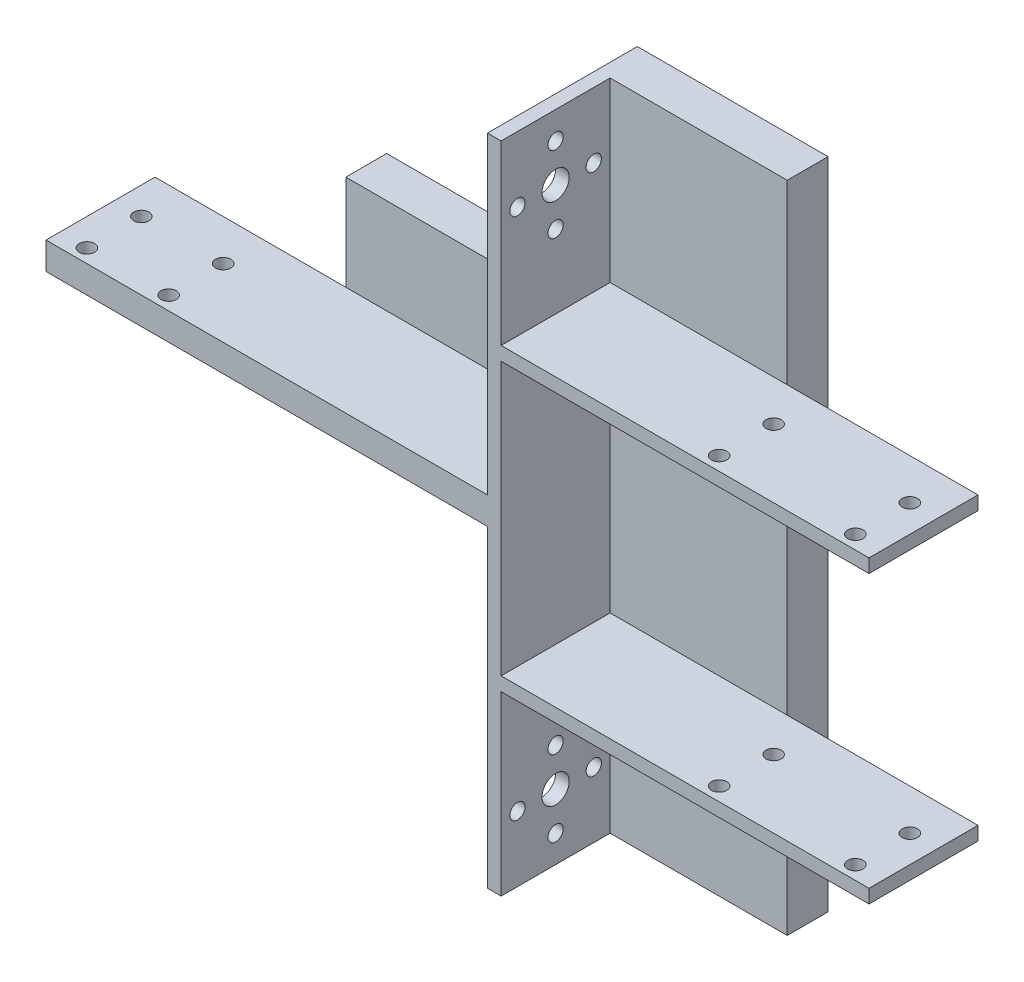
from build123d import *

# Parameters (mm, degrees)
SKETCH1_W           = 46
SKETCH1_H           = 40
SKETCH1_W_2         = 35
SKETCH1_H_2         = 120
BOSS_EXTRUDE2_DEPTH = 7.5
SKETCH2_W           = 46
SKETCH2_H           = 5
SKETCH2_W_2         = 32.5
SKETCH2_H_2         = 2.5
SKETCH2_W_3         = 35
BOSS_EXTRUDE3_DEPTH = 20
SKETCH3_R           = 1.4
CUT_EXTRUDE1_DEPTH  = 60
SKETCH4_R           = 1.4
CUT_EXTRUDE2_DEPTH  = 6
SKETCH6_R           = 1.4
SKETCH6_R_2         = 2.5
CUT_EXTRUDE3_DEPTH  = 2.5


with BuildPart() as part:
    # Sketch1 → Boss-Extrude2 (new body)
    with BuildSketch(Plane.XY):
        with Locations((-58, 0)):
            Rectangle(SKETCH1_W, SKETCH1_H)
        with Locations((-17.5, 0)):
            Rectangle(SKETCH1_W_2, SKETCH1_H_2)
    extrude(amount=BOSS_EXTRUDE2_DEPTH)

    # Sketch2 → Boss-Extrude3 (add)
    with BuildSketch(Plane.XY.offset(7.5)):
        with Locations((-58, 0)):
            Rectangle(SKETCH2_W, SKETCH2_H)
        Polygon((-32.5, 60), (-35, 60), (-35, 20), (-35, 2.5), (-35, -2.5), (-35, -20), (-35, -60), (-32.5, -60), (-32.5, -27.5), (-32.5, -25), (-32.5, 25), (-32.5, 27.5), align=None)
        with Locations((-16.25, 26.25)):
            Rectangle(SKETCH2_W_2, SKETCH2_H_2)
        with Locations((17.5, 26.25)):
            Rectangle(SKETCH2_W_3, SKETCH2_H_2)
        with Locations((17.5, -26.25)):
            Rectangle(SKETCH2_W_3, SKETCH2_H_2)
        with Locations((-16.25, -26.25)):
            Rectangle(SKETCH2_W_2, SKETCH2_H_2)
        with Locations((-98.5, 0)):
            Rectangle(SKETCH2_W_3, SKETCH2_H)
    extrude(amount=BOSS_EXTRUDE3_DEPTH)

    # Sketch3 → Cut-Extrude1 (cut)
    with BuildSketch(Plane.XZ.offset(27.5)):
        with Locations(Location((30, 25, 0), (0, 0, 180))):
            Circle(SKETCH3_R)
        with Locations(Location((30, 15, 0), (0, 0, 180))):
            Circle(SKETCH3_R)
        with Locations(Location((5, 25, 0), (0, 0, 180))):
            Circle(SKETCH3_R)
        with Locations(Location((5, 15, 0), (0, 0, 180))):
            Circle(SKETCH3_R)
    extrude(amount=-CUT_EXTRUDE1_DEPTH, mode=Mode.SUBTRACT)

    # Sketch4 → Cut-Extrude2 (cut)
    with BuildSketch(Plane.XZ.offset(2.5)):
        with Locations((-111, 25)):
            Circle(SKETCH4_R)
        with Locations((-96, 25)):
            Circle(SKETCH4_R)
        with Locations((-96, 15)):
            Circle(SKETCH4_R)
        with Locations((-111, 15)):
            Circle(SKETCH4_R)
    extrude(amount=-CUT_EXTRUDE2_DEPTH, mode=Mode.SUBTRACT)

    # Sketch6 → Cut-Extrude3 (cut)
    with BuildSketch(Plane(origin=(-32.5, 0, 0), x_dir=(0, 0, -1), z_dir=(1, 0, 0))):
        with Locations(Location((-24.5, -48, 0), (0, 0, 90))):
            Circle(SKETCH6_R)
        with Locations(Location((-17.5, -48, 0), (0, 0, 90))):
            Circle(SKETCH6_R_2)
        with Locations(Location((-17.5, -55, 0), (0, 0, 90))):
            Circle(SKETCH6_R)
        with Locations(Location((-17.5, -41, 0), (0, 0, 270))):
            Circle(SKETCH6_R)
        with Locations(Location((-10.5, -48, 0), (0, 0, 270))):
            Circle(SKETCH6_R)
        with Locations(Location((-10.5, 48, 0), (0, 0, 90))):
            Circle(SKETCH6_R)
        with Locations(Location((-17.5, 41, 0), (0, 0, 90))):
            Circle(SKETCH6_R)
        with Locations(Location((-17.5, 55, 0), (0, 0, 270))):
            Circle(SKETCH6_R)
        with Locations(Location((-17.5, 48, 0), (0, 0, 270))):
            Circle(SKETCH6_R_2)
        with Locations(Location((-24.5, 48, 0), (0, 0, 270))):
            Circle(SKETCH6_R)
    extrude(amount=-CUT_EXTRUDE3_DEPTH, mode=Mode.SUBTRACT)


solid = part.part
